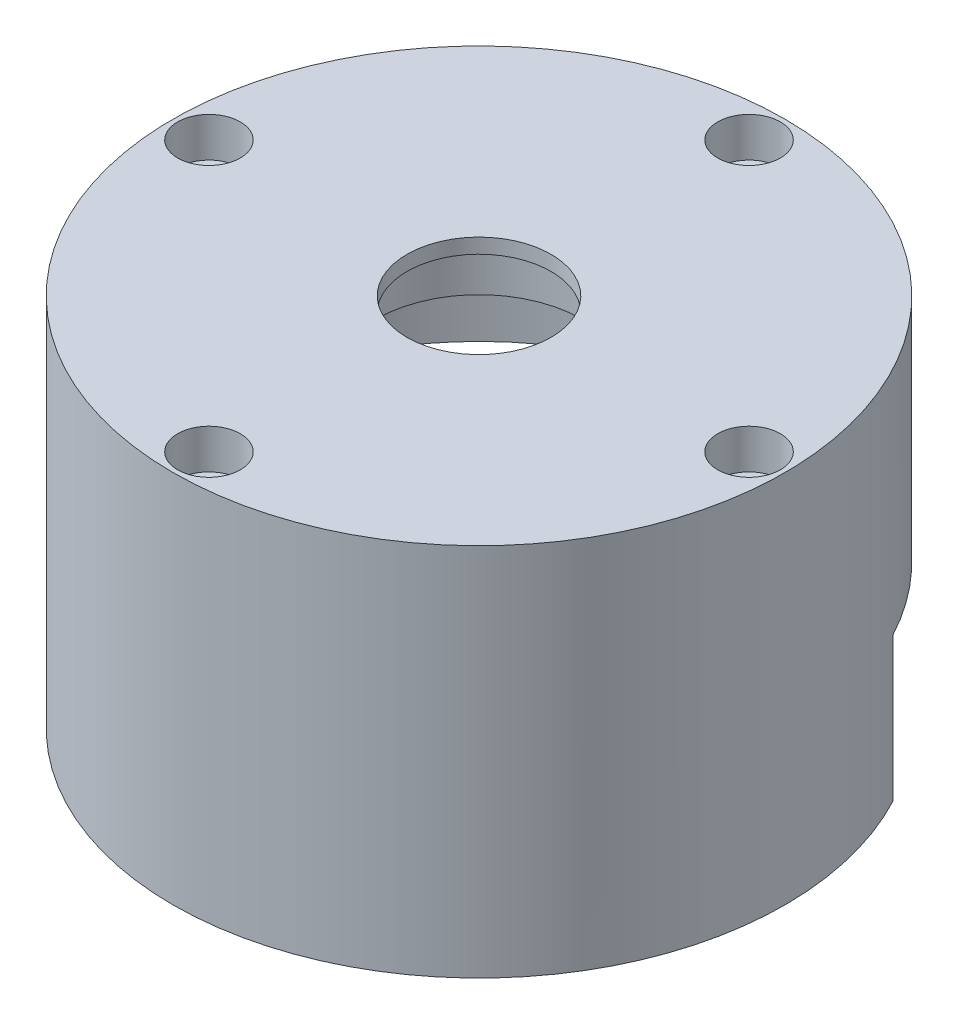
from build123d import *

# Parameters (mm, degrees)
BOSS_EXTRUDE1_DEPTH      = 10
BOSS_EXTRUDE1_DEPTH_BACK = 42
SKETCH1_R                = 42.5
SKETCH1_R_2              = 10
SKETCH1_R_3              = 2.55
SKETCH2_R                = 37.5
CUT_EXTRUDE1_DEPTH       = 44
CUT_EXTRUDE2_START       = -42
CUT_EXTRUDE2_DEPTH       = 20
SKETCH4_R                = 14.35
CUT_EXTRUDE3_DEPTH       = 7.9375
CUT_EXTRUDE4_START       = 10
SKETCH5_R                = 4.35
CUT_EXTRUDE4_DEPTH       = 5.5


with BuildPart() as part:
    # Sketch1 → Boss-Extrude1 (new, two sides: drawn at the far end of the back side and taken through both)
    with BuildSketch(Plane(origin=(0, 0, 0), x_dir=(1, 0, 0), z_dir=(0, 1, 0)).offset(-BOSS_EXTRUDE1_DEPTH_BACK)):
        with Locations(Location((0, 0, 0), (0, 0, 270))):
            Circle(SKETCH1_R)
        with Locations(Location((0, 0, 0), (0, 0, 270))):
            Circle(SKETCH1_R_2, mode=Mode.SUBTRACT)
        with Locations(Location((-37.5, 0, 0), (0, 0, 270))):
            Circle(SKETCH1_R_3, mode=Mode.SUBTRACT)
        with Locations(Location((0, -37.5, 0), (0, 0, 270))):
            Circle(SKETCH1_R_3, mode=Mode.SUBTRACT)
        with Locations(Location((37.5, 0, 0), (0, 0, 270))):
            Circle(SKETCH1_R_3, mode=Mode.SUBTRACT)
        with Locations(Location((0, 37.5, 0), (0, 0, 270))):
            Circle(SKETCH1_R_3, mode=Mode.SUBTRACT)
    extrude(amount=BOSS_EXTRUDE1_DEPTH + BOSS_EXTRUDE1_DEPTH_BACK)

    # Sketch2 → Cut-Extrude1 (cut)
    with BuildSketch(Plane(origin=(0, 0, 0), x_dir=(1, 0, 0), z_dir=(0, 1, 0))):
        Circle(SKETCH2_R)
    extrude(amount=-CUT_EXTRUDE1_DEPTH, mode=Mode.SUBTRACT)

    # Sketch3 → Cut-Extrude2 (cut)
    with BuildSketch(Plane(origin=(0, 0, 0), x_dir=(1, 0, 0), z_dir=(0, 1, 0)).offset(CUT_EXTRUDE2_START)):
        Polygon((-37.5, 0), (-37.5, 48.535526989), (-12.5, 48.535526989), (-12.5, 25.15870532), (12.5, 25.15870532), (12.5, 48.535526989), (37.5, 48.535526989), (37.5, 0), align=None)
    extrude(amount=CUT_EXTRUDE2_DEPTH, mode=Mode.SUBTRACT)

    # Sketch4 → Cut-Extrude3 (cut)
    with BuildSketch(Plane(origin=(0, 0, 0), x_dir=(1, 0, 0), z_dir=(0, 1, 0))):
        with Locations(Location((0, 0, 0), (0, 0, 270))):
            Circle(SKETCH4_R)
    extrude(amount=CUT_EXTRUDE3_DEPTH, mode=Mode.SUBTRACT)

    # Sketch5 → Cut-Extrude4 (cut)
    with BuildSketch(Plane(origin=(0, 0, 0), x_dir=(1, 0, 0), z_dir=(0, 1, 0)).offset(CUT_EXTRUDE4_START)):
        with Locations(Location((0, 37.5, 0), (0, 0, 270))):
            Circle(SKETCH5_R)
        with Locations(Location((37.5, 0, 0), (0, 0, 270))):
            Circle(SKETCH5_R)
        with Locations(Location((0, -37.5, 0), (0, 0, 270))):
            Circle(SKETCH5_R)
        with Locations(Location((-37.5, 0, 0), (0, 0, 270))):
            Circle(SKETCH5_R)
    extrude(amount=-CUT_EXTRUDE4_DEPTH, mode=Mode.SUBTRACT)


solid = part.part
